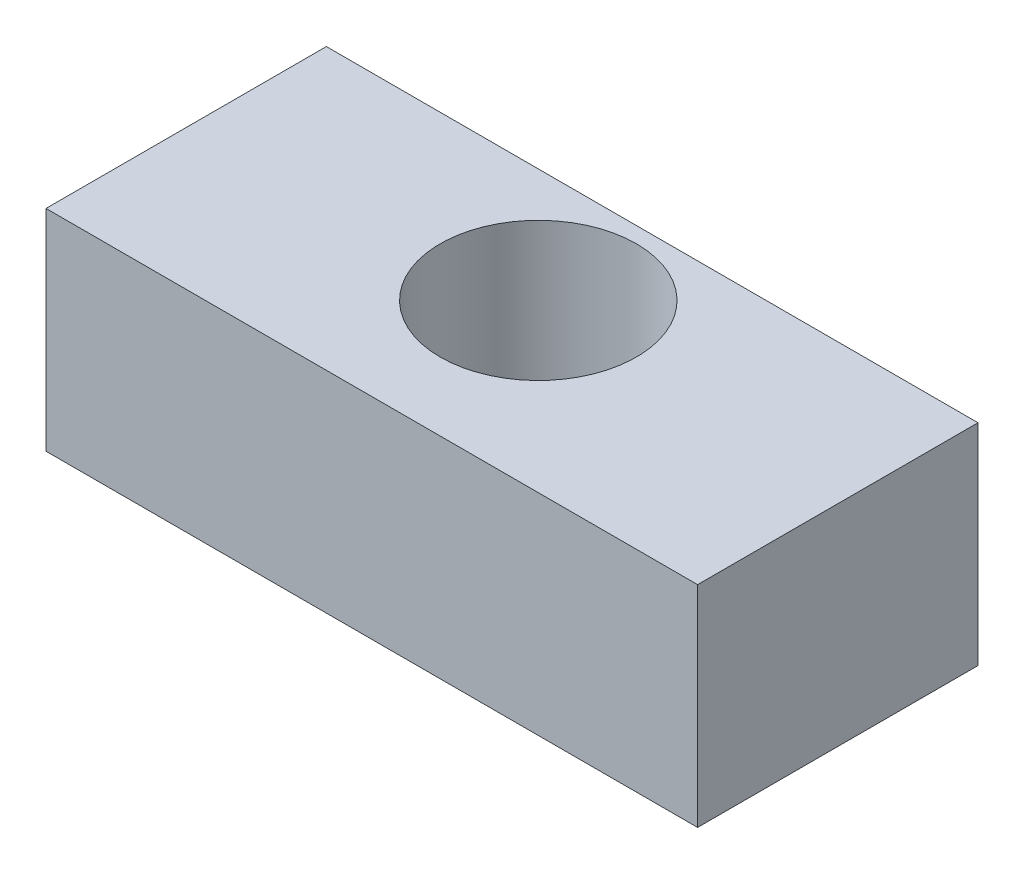
from build123d import *

# Parameters (mm, degrees)
SKETCH1_W           = 29.513896991
SKETCH1_H           = 12.7
SKETCH1_R           = 4.445
BOSS_EXTRUDE1_DEPTH = 9.525


with BuildPart() as part:
    # Sketch1 → Boss-Extrude1 (new body)
    with BuildSketch(Plane(origin=(0, 0, 0), x_dir=(1, 0, 0), z_dir=(0, 1, 0))):
        with Locations((14.756948496, 6.35)):
            Rectangle(SKETCH1_W, SKETCH1_H)
        with Locations(Location((14.756948496, 7.540625, 0), (0, 0, 90))):
            Circle(SKETCH1_R, mode=Mode.SUBTRACT)
    extrude(amount=BOSS_EXTRUDE1_DEPTH)


solid = part.part
